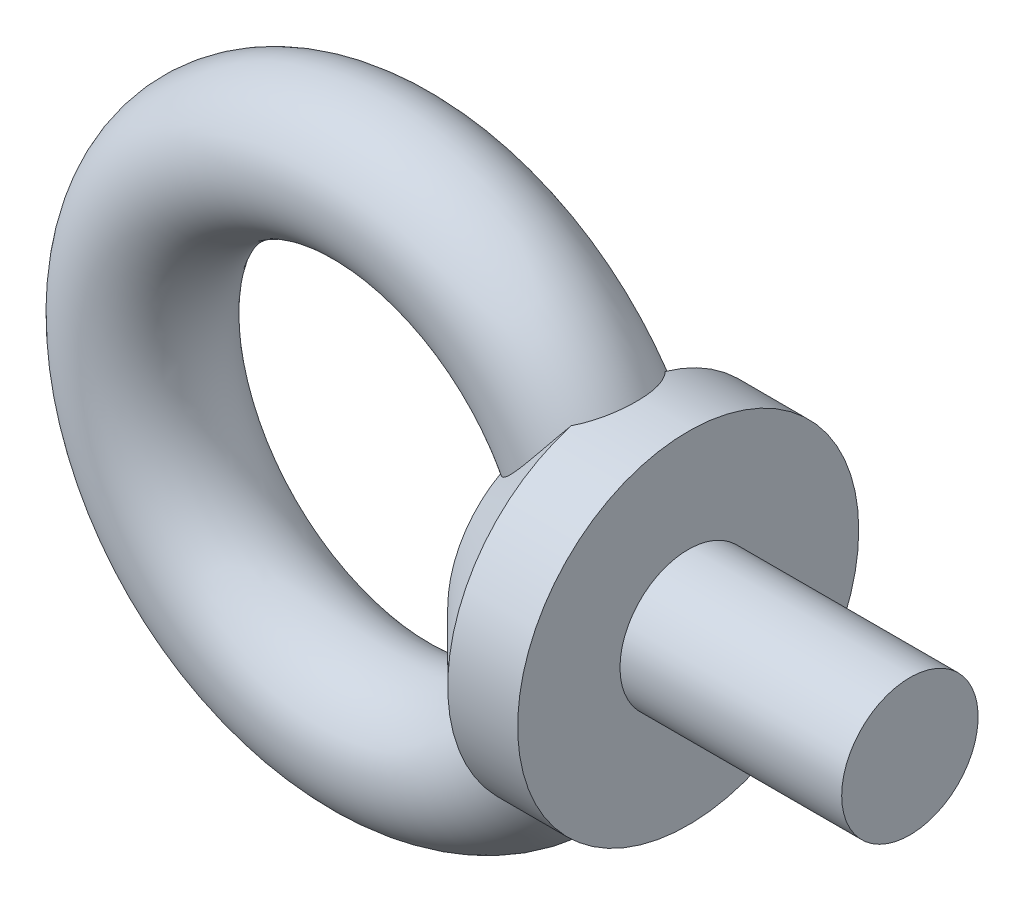
from build123d import *

# Parameters (mm, degrees)
IZIM2_R                     = 4
Y_KSEKLIK_EKSTR_ZYON1_START = 18
IZIM4_R                     = 10
Y_KSEKLIK_EKSTR_ZYON1_DEPTH = 8.1
PAH1_SIZE                   = 4
IZIM6_R                     = 4
Y_KSEKLIK_EKSTR_ZYON2_DEPTH = 13


with BuildPart() as part:
    # Süpür1: sweep along a path in Çizim1
    with BuildLine(Plane.XY) as s_p_r1_path:
        CenterArc((0, 0), 14, 0, 360)
    # Çizim2 → Süpür1 (sweep)
    with BuildSketch(Plane(origin=(0, 0, 0), x_dir=(1, 0, 0), z_dir=(0, 1, 0))):
        with Locations((14, 0)):
            Circle(IZIM2_R)
    sweep(path=s_p_r1_path.line)

    # Çizim4 → Yükseklik-Ekstrüzyon1 (add)
    with BuildSketch(Plane(origin=(0, 0, 0), x_dir=(0, 0, -1), z_dir=(1, 0, 0)).offset(Y_KSEKLIK_EKSTR_ZYON1_START)):
        Circle(IZIM4_R)
    extrude(amount=-Y_KSEKLIK_EKSTR_ZYON1_DEPTH)

    # Pah1
    pah1_edges = [part.edges().sort_by_distance(p)[0] for p in [
        (9.9, 0, 10),
        (9.9, 5.491506193, -8.357233976),
    ]]
    chamfer(pah1_edges, length=PAH1_SIZE)

    # Çizim6 → Yükseklik-Ekstrüzyon2 (add)
    with BuildSketch(Plane(origin=(18, 0, 0), x_dir=(0, 0, -1), z_dir=(1, 0, 0))):
        with Locations(Location((0, 0, 0), (0, 0, 180))):
            Circle(IZIM6_R)
    extrude(amount=Y_KSEKLIK_EKSTR_ZYON2_DEPTH)


solid = part.part
